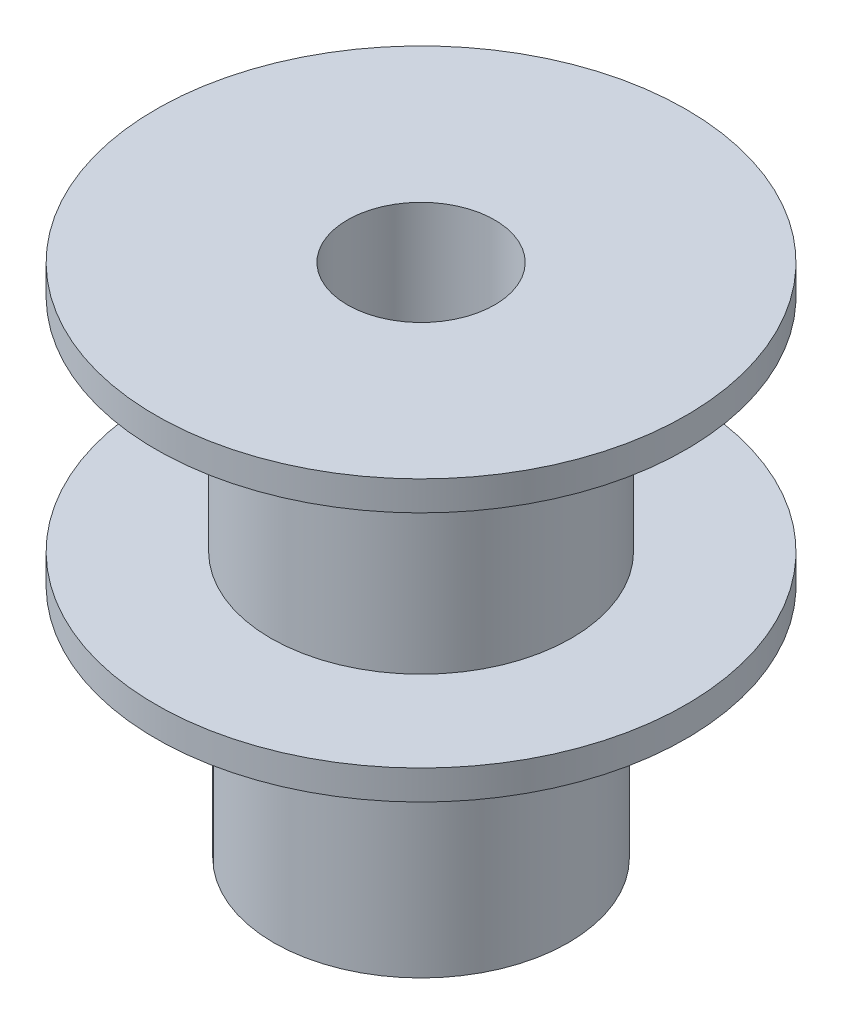
from build123d import *

# Parameters (mm, degrees)
SKETCH3_R               = 2.5
CUT_EXTRUDE2_DEPTH      = 22.639085008
CUT_EXTRUDE3_REACH      = 23.639
CUT_EXTRUDE3_END_RADIUS = 5
SKETCH4_R               = 1.5


with BuildPart() as part:
    # Sketch1 → Revolve1 (revolve)
    with BuildSketch(Plane.XY, mode=Mode.PRIVATE) as revolve1_sk:
        Polygon((0, 0), (0, 17.5), (9, 17.5), (9, 16.5), (5.1, 16.5), (5.1, 9), (9, 9), (9, 8), (5, 8), (5, 0), align=None)
    revolve(revolve1_sk.sketch.rotate(Axis((0, 0, 0), (0, 1, 0)), 90), axis=Axis((0, 0, 0), (0, 1, 0)))

    # Sketch3 → Cut-Extrude2 (cut, through all)
    with BuildSketch(Plane(origin=(0, 17.5, 0), x_dir=(1, 0, 0), z_dir=(0, 1, 0))):
        with Locations(Location((0, 0, 0), (0, 0, 270))):
            Circle(SKETCH3_R)
    extrude(amount=-CUT_EXTRUDE2_DEPTH, mode=Mode.SUBTRACT)

    # Cut-Extrude3: up to this cylinder (the profile starts inside it)
    cut_extrude3_end = Plane(origin=(0, 4, 0), z_dir=(0, -1, 0)) * Cylinder(CUT_EXTRUDE3_END_RADIUS, 58.278, mode=Mode.PRIVATE)
    # Sketch4 → Cut-Extrude3 (cut, up to the surface)
    with BuildSketch(Plane(origin=(0, 0, 0), x_dir=(0, 0, -1), z_dir=(1, 0, 0)), mode=Mode.PRIVATE) as cut_extrude3_sk1:
        with Locations((0, 4)):
            Circle(SKETCH4_R)
    cut_extrude3_tool1 = extrude(cut_extrude3_sk1.sketch, amount=-CUT_EXTRUDE3_REACH, mode=Mode.PRIVATE) & cut_extrude3_end
    add(cut_extrude3_tool1.solids().sort_by_distance((0, 4, 0))[0], mode=Mode.SUBTRACT)


solid = part.part
